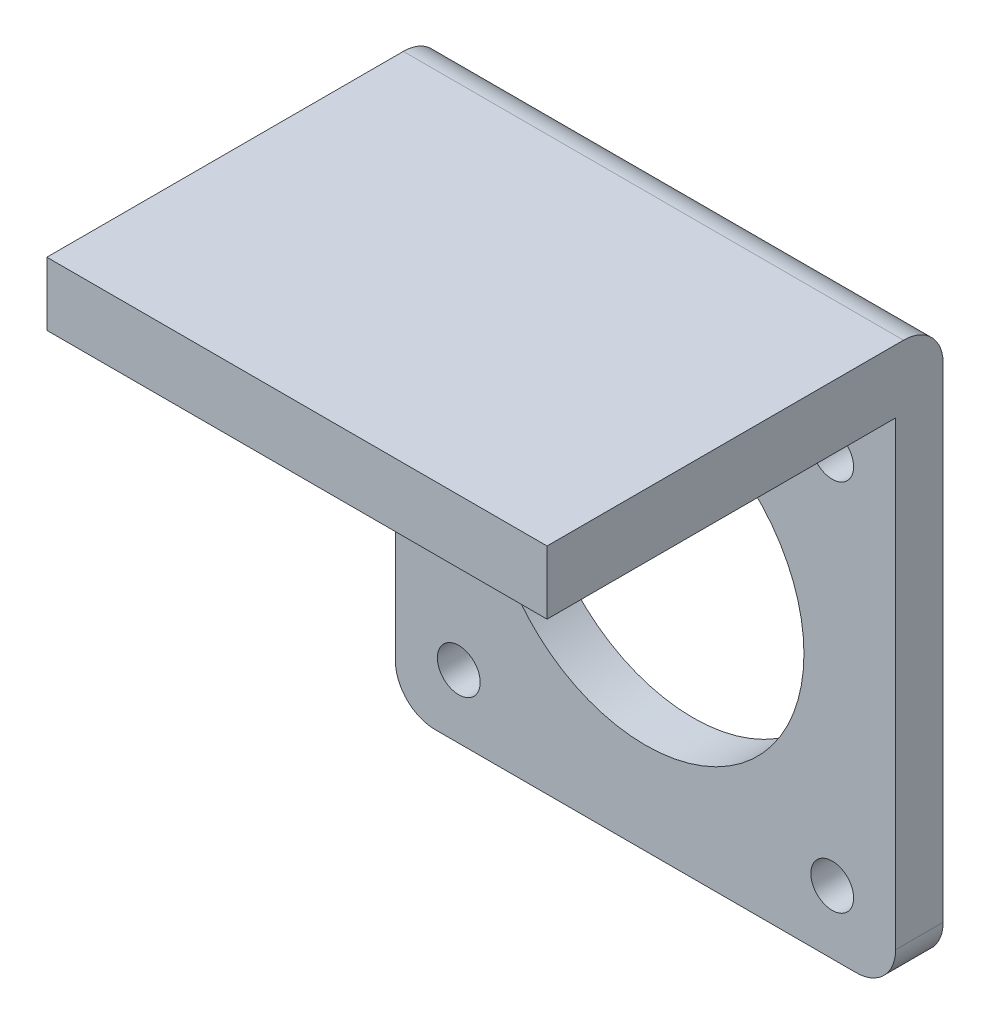
from build123d import *

# Parameters (mm, degrees)
CROQUIS1_R              = 2.7
CROQUIS1_R_2            = 20
SALIENTE_EXTRUIR1_DEPTH = 6
CROQUIS2_W              = 63.14
CROQUIS2_H              = 8
SALIENTE_EXTRUIR2_DEPTH = 50
REDONDEO1_R             = 5


with BuildPart() as part:
    # Croquis1 → Saliente-Extruir1 (new body)
    with BuildSketch(Plane.XY):
        with BuildLine():
            Line((-8, -50.14), (-8, 8))
            Line((-8, 8), (55.14, 8))
            Line((55.14, 8), (55.14, -50.14))
            ThreePointArc((55.14, -50.14), (53.675533906, -53.675533906), (50.14, -55.14))
            Line((50.14, -55.14), (-3, -55.14))
            ThreePointArc((-3, -55.14), (-6.535533906, -53.675533906), (-8, -50.14))
        make_face()
        Circle(CROQUIS1_R, mode=Mode.SUBTRACT)
        with Locations((47.14, 0)):
            Circle(CROQUIS1_R, mode=Mode.SUBTRACT)
        with Locations((47.14, -47.14)):
            Circle(CROQUIS1_R, mode=Mode.SUBTRACT)
        with Locations((0, -47.14)):
            Circle(CROQUIS1_R, mode=Mode.SUBTRACT)
        with Locations((23.57, -23.57)):
            Circle(CROQUIS1_R_2, mode=Mode.SUBTRACT)
    extrude(amount=SALIENTE_EXTRUIR1_DEPTH)

    # Croquis2 → Saliente-Extruir2 (add)
    with BuildSketch(Plane(origin=(0, 0, 0), x_dir=(-1, 0, 0), z_dir=(0, 0, -1))):
        with Locations((-23.57, 12)):
            Rectangle(CROQUIS2_W, CROQUIS2_H)
    extrude(amount=-SALIENTE_EXTRUIR2_DEPTH)

    # Redondeo1
    redondeo1_edges = [part.edges().sort_by_distance(p)[0] for p in [
        (23.57, 16, 0),
    ]]
    fillet(redondeo1_edges, radius=REDONDEO1_R)


solid = part.part
